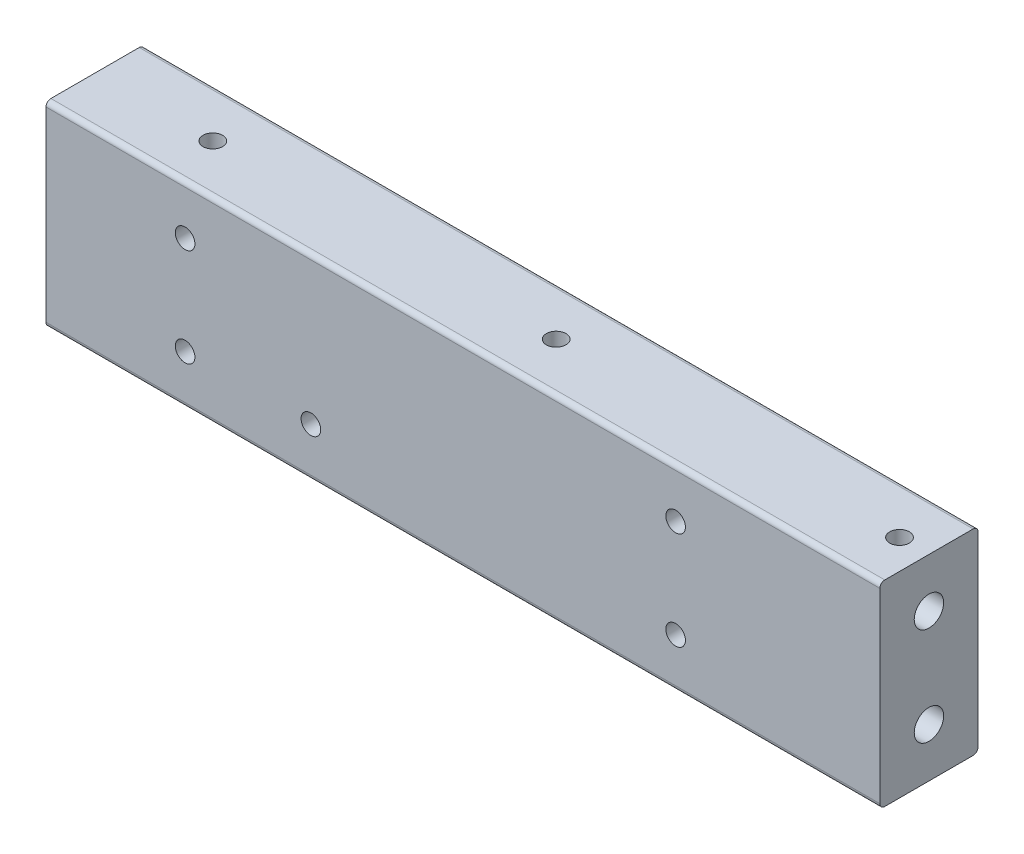
from build123d import *

# Parameters (mm, degrees)
SKETCH_1_W          = 170
SKETCH_1_H          = 40
EXTRUDE_1_DEPTH     = 20
FILLET_1_R          = 1
SKETCH_2_R          = 3
CUT_EXTRUDE_1_DEPTH = 176.783958312
SKETCH_4_R          = 2
CUT_EXTRUDE_2_DEPTH = 20
SKETCH_6_R          = 2
CUT_EXTRUDE_3_DEPTH = 20
SKETCH_7_R          = 2
CUT_EXTRUDE_4_DEPTH = 40


with BuildPart() as part:
    # 草图1 → 凸台-拉伸1 (new body)
    with BuildSketch(Plane.XY):
        with Locations((85, 20)):
            Rectangle(SKETCH_1_W, SKETCH_1_H)
    extrude(amount=EXTRUDE_1_DEPTH)

    # 圆角1
    fillet_1_edges = [part.edges().sort_by_distance(p)[0] for p in [
        (85, 40, 20),
        (85, 40, 0),
        (85, 0, 0),
        (85, 0, 20),
    ]]
    fillet(fillet_1_edges, radius=FILLET_1_R)

    # 草图2 → 切除-拉伸1 (cut, through all)
    with BuildSketch(Plane.ZY):
        with Locations((10, 30)):
            Circle(SKETCH_2_R)
        with Locations((10, 10)):
            Circle(SKETCH_2_R)
    extrude(amount=-CUT_EXTRUDE_1_DEPTH, mode=Mode.SUBTRACT)

    # 草图4 → 切除-拉伸2 (cut)
    with BuildSketch(Plane(origin=(0, 0, 0), x_dir=(-1, 0, 0), z_dir=(0, 0, -1))):
        with Locations((-128.355339059, 9.999999996)):
            Circle(SKETCH_4_R)
        with Locations((-128.355339059, 29.999999996)):
            Circle(SKETCH_4_R)
        with Locations((-28.355339059, 9.999999996)):
            Circle(SKETCH_4_R)
        with Locations((-28.355339059, 29.999999996)):
            Circle(SKETCH_4_R)
    extrude(amount=-CUT_EXTRUDE_2_DEPTH, mode=Mode.SUBTRACT)

    # 草图6 → 切除-拉伸3 (cut)
    with BuildSketch(Plane(origin=(0, 0, 0), x_dir=(-1, 0, 0), z_dir=(0, 0, -1))):
        with Locations((-54, 10)):
            Circle(SKETCH_6_R)
    extrude(amount=-CUT_EXTRUDE_3_DEPTH, mode=Mode.SUBTRACT)

    # 草图7 → 切除-拉伸4 (cut)
    with BuildSketch(Plane.XZ):
        with Locations(Location((164, 10, 0), (0, 0, 270))):
            Circle(SKETCH_7_R)
        with Locations(Location((94, 10, 0), (0, 0, 270))):
            Circle(SKETCH_7_R)
        with Locations(Location((24, 10, 0), (0, 0, 270))):
            Circle(SKETCH_7_R)
    extrude(amount=-CUT_EXTRUDE_4_DEPTH, mode=Mode.SUBTRACT)


solid = part.part
